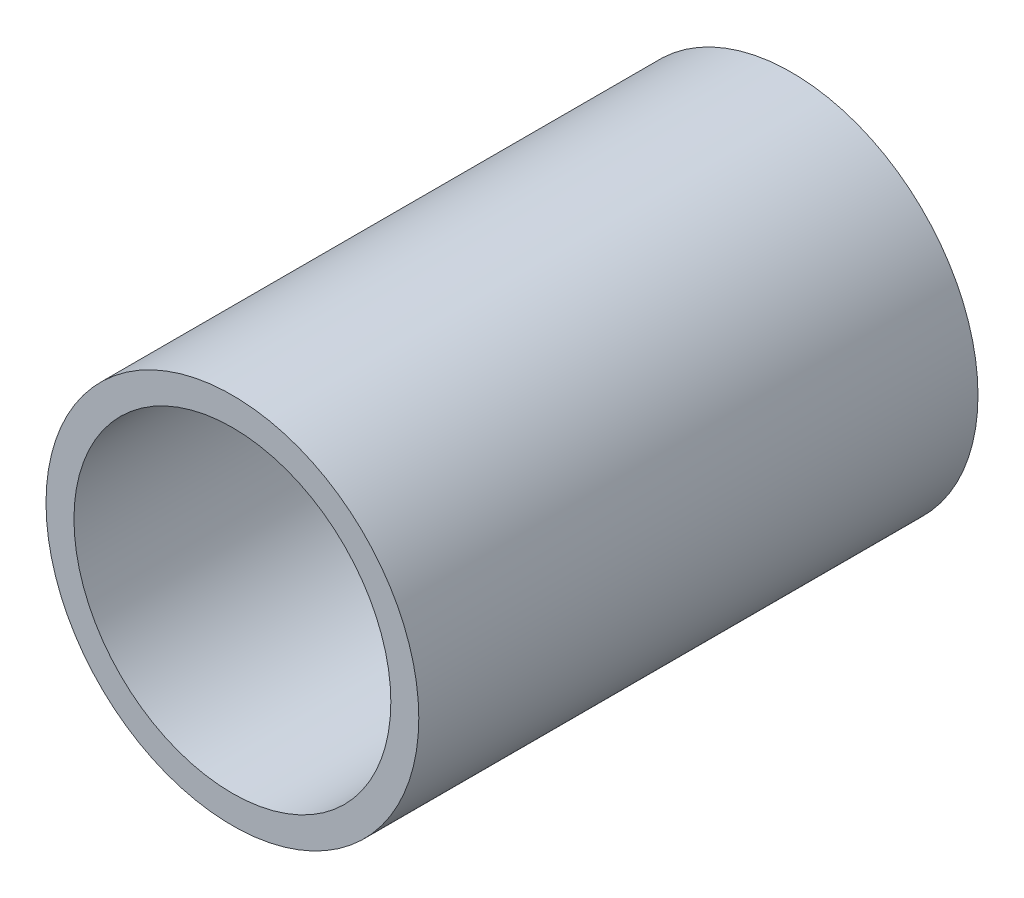
from build123d import *

# Parameters (mm, degrees)
BOSS_EXTRUDE1_DEPTH      = 150
BOSS_EXTRUDE1_DEPTH_BACK = 150
SKETCH1_R                = 100
SKETCH2_R                = 85
CUT_EXTRUDE1_DEPTH       = 330


with BuildPart() as part:
    # Sketch1 → Boss-Extrude1 (new, two sides: drawn at the far end of the back side and taken through both)
    with BuildSketch(Plane.XY.offset(-BOSS_EXTRUDE1_DEPTH_BACK)):
        Circle(SKETCH1_R)
    extrude(amount=BOSS_EXTRUDE1_DEPTH + BOSS_EXTRUDE1_DEPTH_BACK)

    # Sketch2 → Cut-Extrude1 (cut)
    with BuildSketch(Plane.XY.offset(150)):
        Circle(SKETCH2_R)
    extrude(amount=-CUT_EXTRUDE1_DEPTH, mode=Mode.SUBTRACT)


solid = part.part
